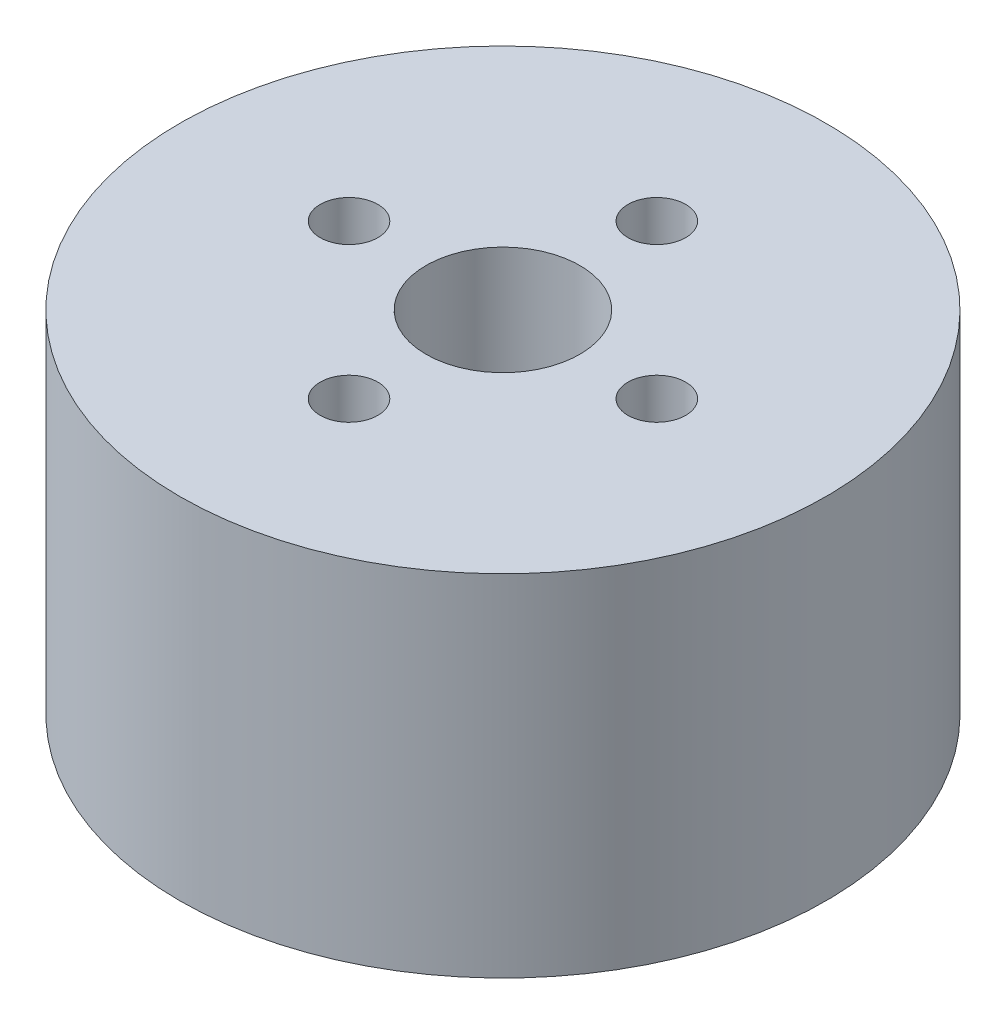
from build123d import *

# Parameters (mm, degrees)
SKETCH1_R           = 16.8
BOSS_EXTRUDE1_DEPTH = 18.2
SKETCH2_R           = 4
CUT_EXTRUDE1_DEPTH  = 30.928581657
SKETCH3_R           = 1.5
CUT_EXTRUDE2_DEPTH  = 5
SKETCH4_R           = 1.5
CUT_EXTRUDE3_DEPTH  = 5


with BuildPart() as part:
    # Sketch1 → Boss-Extrude1 (new body)
    with BuildSketch(Plane(origin=(0, 0, 0), x_dir=(1, 0, 0), z_dir=(0, 1, 0))):
        with Locations(Location((0, 0, 0), (0, 0, 270))):
            Circle(SKETCH1_R)
    extrude(amount=BOSS_EXTRUDE1_DEPTH)

    # Sketch2 → Cut-Extrude1 (cut, through all)
    with BuildSketch(Plane(origin=(0, 18.2, 0), x_dir=(1, 0, 0), z_dir=(0, 1, 0))):
        with Locations(Location((0, 0, 0), (0, 0, 270))):
            Circle(SKETCH2_R)
    extrude(amount=-CUT_EXTRUDE1_DEPTH, mode=Mode.SUBTRACT)

    # Sketch3 → Cut-Extrude2 (cut)
    with BuildSketch(Plane(origin=(0, 18.2, 0), x_dir=(1, 0, 0), z_dir=(0, 1, 0))):
        with Locations(Location((0, 8, 0), (0, 0, 270))):
            Circle(SKETCH3_R)
        with Locations(Location((8, 0, 0), (0, 0, 270))):
            Circle(SKETCH3_R)
        with Locations(Location((0, -8, 0), (0, 0, 270))):
            Circle(SKETCH3_R)
        with Locations(Location((-8, 0, 0), (0, 0, 270))):
            Circle(SKETCH3_R)
    extrude(amount=-CUT_EXTRUDE2_DEPTH, mode=Mode.SUBTRACT)

    # Sketch4 → Cut-Extrude3 (cut)
    with BuildSketch(Plane.XZ):
        with Locations(Location((0, 11.25, 0), (0, 0, 270))):
            Circle(SKETCH4_R)
        with Locations(Location((11.25, 0, 0), (0, 0, 270))):
            Circle(SKETCH4_R)
        with Locations(Location((0, -11.25, 0), (0, 0, 270))):
            Circle(SKETCH4_R)
        with Locations(Location((-11.25, 0, 0), (0, 0, 270))):
            Circle(SKETCH4_R)
    extrude(amount=-CUT_EXTRUDE3_DEPTH, mode=Mode.SUBTRACT)


solid = part.part
